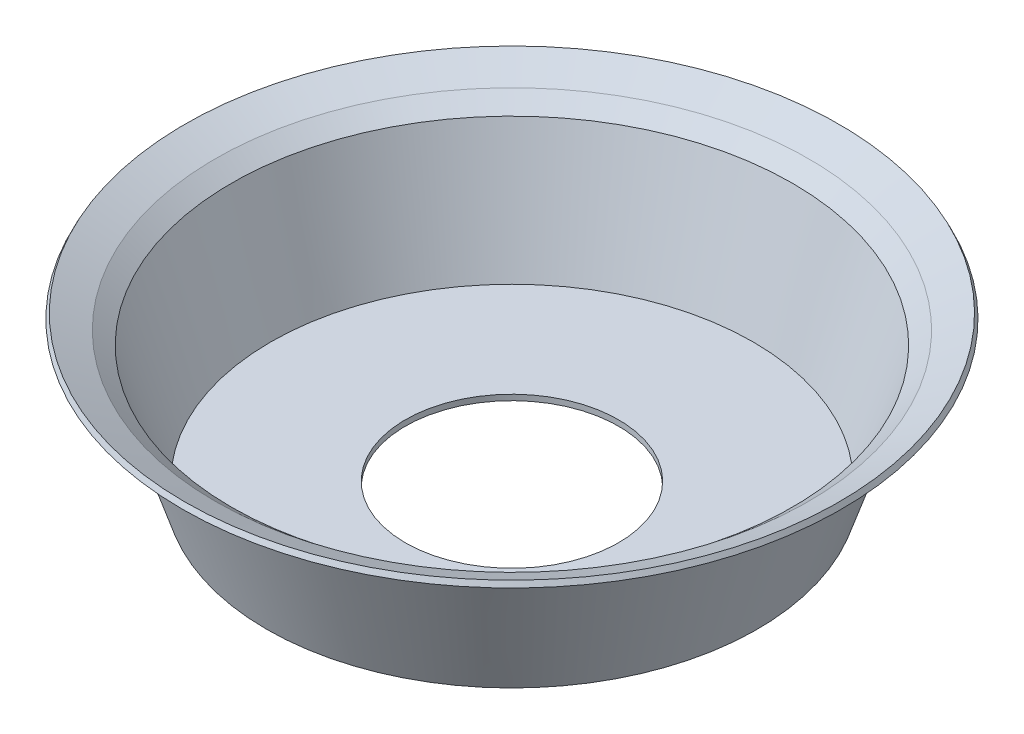
from build123d import *


with BuildPart() as part:
    # Эскиз1 → Повернуть-Тонкостенный1 (revolve)
    with BuildSketch(Plane.XY, mode=Mode.PRIVATE) as revolve_1_sk:
        Polygon((19, 0), (43, 0), (50, 21), (52.889577147, 23.332201276), (58.302767501, 25.953006302), (58.738533119, 25.052946123), (53.42847461, 22.482072549), (50.856038751, 20.405838593), (43.72075922, -1), (19, -1), align=None)
    revolve(revolve_1_sk.sketch.rotate(Axis((0, 0, 0), (0, -1, 0)), 90), axis=Axis((0, 0, 0), (0, -1, 0)))


solid = part.part
